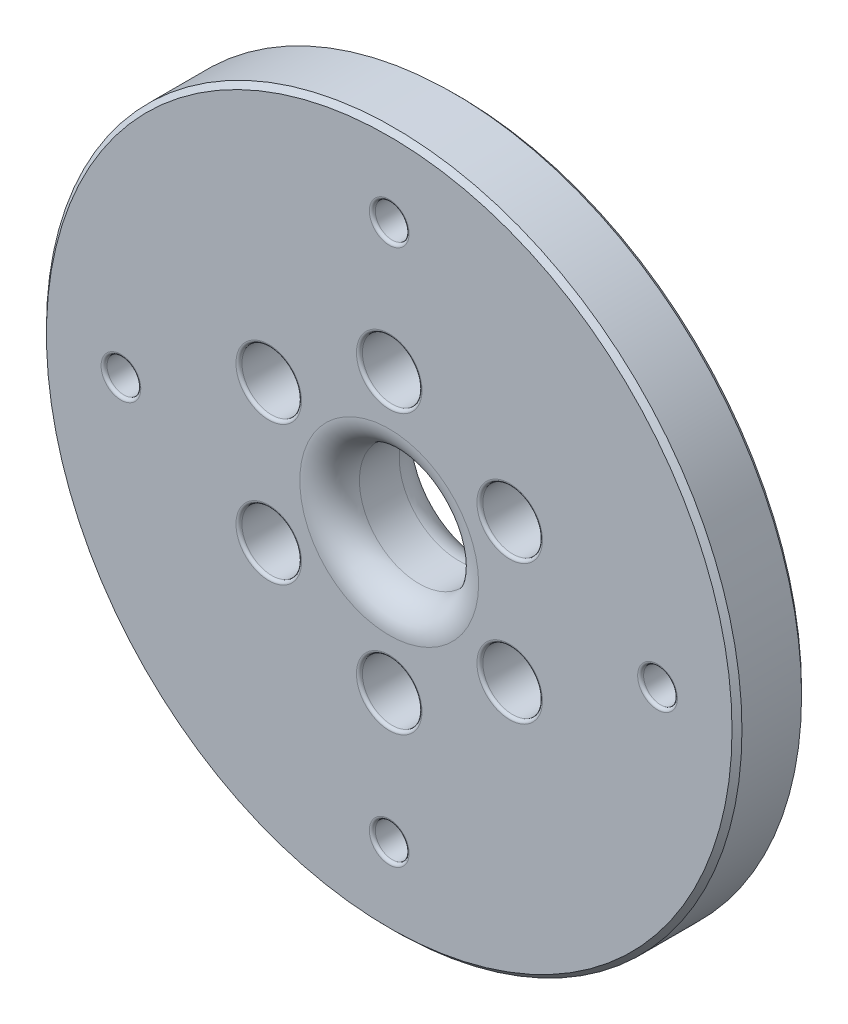
from build123d import *

# Parameters (mm, degrees)
SKETCH_2_R                   = 18.5
EXTRUDE_1_DEPTH              = 3
SKETCH_3_R                   = 35
EXTRUDE_2_DEPTH              = 7
HOLE_WIZARD_M3_1_D           = 3.2
HOLE_WIZARD_M3_1_DEPTH       = 14.03862301
HOLE_WIZARD_M3_1_CBORE_D     = 6
HOLE_WIZARD_M3_1_CBORE_DEPTH = 5
HOLE_WIZARD_M3_1_TIP         = 0.96137699
CUT_EXTRUDE_1_DEPTH          = 51.497524692
CUT_EXTRUDE_1_DEPTH_BACK     = 51.497524692
SKETCH_6_R                   = 6
FILLET_1_R                   = 1
CHAMFER_1_SIZE               = 0.5
FILLET_2_R                   = 0.3
FILLET_3_R                   = 3
FILLET_4_R                   = 3
HOLE_WIZARD_M3_1_2_D         = 3.4
SKETCH_10_W                  = 5.45
SKETCH_10_H                  = 5.45
CUT_EXTRUDE_2_DEPTH          = 2.45
FILLET_5_R                   = 0.3


with BuildPart() as part:
    # 스케치2 → 보스-돌출1 (new body)
    with BuildSketch(Plane.XY):
        Circle(SKETCH_2_R)
    extrude(amount=EXTRUDE_1_DEPTH)

    # 스케치3 → 보스-돌출2 (add)
    with BuildSketch(Plane.XY.offset(3)):
        Circle(SKETCH_3_R)
    extrude(amount=EXTRUDE_2_DEPTH)

    # Hole Wizard M3 _ _ _ _ _ _1
    with Locations(Plane.XY.offset(10)):
        with Locations((12.124355653, -7), (12.124355653, 7), (0, 14), (-12.124355653, 7), (0, -14), (-12.124355653, -7)):
            CounterBoreHole(HOLE_WIZARD_M3_1_D / 2, HOLE_WIZARD_M3_1_CBORE_D / 2, HOLE_WIZARD_M3_1_CBORE_DEPTH, depth=HOLE_WIZARD_M3_1_DEPTH)
            with Locations((0, 0, -(HOLE_WIZARD_M3_1_DEPTH + HOLE_WIZARD_M3_1_TIP / 2))):  # 118° drill point
                Cone(0, HOLE_WIZARD_M3_1_D / 2, HOLE_WIZARD_M3_1_TIP, mode=Mode.SUBTRACT)

    # 스케치6 → 컷-돌출1 (cut, two sides: drawn at the far end of the back side and taken through both)
    with BuildSketch(Plane.XY.offset(10).offset(-CUT_EXTRUDE_1_DEPTH_BACK)):
        Circle(SKETCH_6_R)
    extrude(amount=CUT_EXTRUDE_1_DEPTH + CUT_EXTRUDE_1_DEPTH_BACK, mode=Mode.SUBTRACT)

    # 필렛1
    fillet_1_edges = [part.edges().sort_by_distance(p)[0] for p in [
        (-18.5, 0, 3),
    ]]
    fillet(fillet_1_edges, radius=FILLET_1_R)

    # 모따기1
    chamfer_1_edges = [part.edges().sort_by_distance(p)[0] for p in [
        (-18.5, 0, 0),
        (-35, 0, 3),
        (-35, 0, 10),
    ]]
    chamfer(chamfer_1_edges, length=CHAMFER_1_SIZE)

    # 필렛2
    fillet_2_edges = [part.edges().sort_by_distance(p)[0] for p in [
        (-10.524355653, -7, 0),
        (-15.124355653, -7, 10),
        (-10.524355653, -7, 5),
        (-15.124355653, -7, 5),
        (1.6, -14, 0),
        (-3, -14, 10),
        (1.6, -14, 5),
        (-3, -14, 5),
        (-10.524355653, 7, 0),
        (-15.124355653, 7, 10),
        (-10.524355653, 7, 5),
        (-15.124355653, 7, 5),
        (1.6, 14, 0),
        (-3, 14, 10),
        (1.6, 14, 5),
        (-3, 14, 5),
        (13.724355653, 7, 0),
        (9.124355653, 7, 10),
        (13.724355653, 7, 5),
        (9.124355653, 7, 5),
        (13.724355653, -7, 0),
        (9.124355653, -7, 10),
        (13.724355653, -7, 5),
        (9.124355653, -7, 5),
    ]]
    fillet(fillet_2_edges, radius=FILLET_2_R)

    # 필렛3
    fillet_3_edges = [part.edges().sort_by_distance(p)[0] for p in [
        (-6, 0, 10),
    ]]
    fillet(fillet_3_edges, radius=FILLET_3_R)

    # 필렛4
    fillet_4_edges = [part.edges().sort_by_distance(p)[0] for p in [
        (-6, 0, 0),
    ]]
    fillet(fillet_4_edges, radius=FILLET_4_R)

    # Hole Wizard M3 _ _1 2 (through all)
    with Locations(Plane(origin=(0, 0, 3), x_dir=(-1, 0, 0), z_dir=(0, 0, -1))):
        with Locations((0, 27), (27, 0), (0, -27), (-27, 0)):
            Hole(HOLE_WIZARD_M3_1_2_D / 2)

    # 스케치10 → 컷-돌출2 (cut)
    with BuildSketch(Plane(origin=(0, 0, 3), x_dir=(-1, 0, 0), z_dir=(0, 0, -1))):
        with Locations((-27, 0)):
            Rectangle(SKETCH_10_W, SKETCH_10_H)
        with Locations((0, 27)):
            Rectangle(SKETCH_10_W, SKETCH_10_H)
        with Locations((27, 0)):
            Rectangle(SKETCH_10_W, SKETCH_10_H)
        with Locations((0, -27)):
            Rectangle(SKETCH_10_W, SKETCH_10_H)
    extrude(amount=-CUT_EXTRUDE_2_DEPTH, mode=Mode.SUBTRACT)

    # 필렛5
    fillet_5_edges = [part.edges().sort_by_distance(p)[0] for p in [
        (25.3, 0, 10),
        (-1.7, -27, 10),
        (-28.7, 0, 10),
        (-1.7, 27, 10),
        (25.3, 0, 5.45),
        (24.275, 0, 3),
        (27, 2.725, 3),
        (29.725, 0, 3),
        (27, -2.725, 3),
        (24.275, 0, 5.45),
        (24.275, 2.725, 4.225),
        (27, -2.725, 5.45),
        (24.275, -2.725, 4.225),
        (29.725, 0, 5.45),
        (29.725, -2.725, 4.225),
        (27, 2.725, 5.45),
        (29.725, 2.725, 4.225),
        (-1.7, 27, 5.45),
        (-2.725, 27, 3),
        (0, 29.725, 3),
        (2.725, 27, 3),
        (0, 24.275, 3),
        (-2.725, 27, 5.45),
        (-2.725, 29.725, 4.225),
        (0, 24.275, 5.45),
        (-2.725, 24.275, 4.225),
        (2.725, 27, 5.45),
        (2.725, 24.275, 4.225),
        (0, 29.725, 5.45),
        (2.725, 29.725, 4.225),
        (-28.7, 0, 5.45),
        (-29.725, 0, 3),
        (-27, 2.725, 3),
        (-24.275, 0, 3),
        (-27, -2.725, 3),
        (-29.725, 0, 5.45),
        (-29.725, 2.725, 4.225),
        (-27, -2.725, 5.45),
        (-29.725, -2.725, 4.225),
        (-24.275, 0, 5.45),
        (-24.275, -2.725, 4.225),
        (-27, 2.725, 5.45),
        (-24.275, 2.725, 4.225),
        (-1.7, -27, 5.45),
        (-2.725, -27, 3),
        (0, -24.275, 3),
        (2.725, -27, 3),
        (0, -29.725, 3),
        (-2.725, -27, 5.45),
        (-2.725, -24.275, 4.225),
        (0, -29.725, 5.45),
        (-2.725, -29.725, 4.225),
        (2.725, -27, 5.45),
        (2.725, -29.725, 4.225),
        (0, -24.275, 5.45),
        (2.725, -24.275, 4.225),
    ]]
    fillet(fillet_5_edges, radius=FILLET_5_R)


solid = part.part
